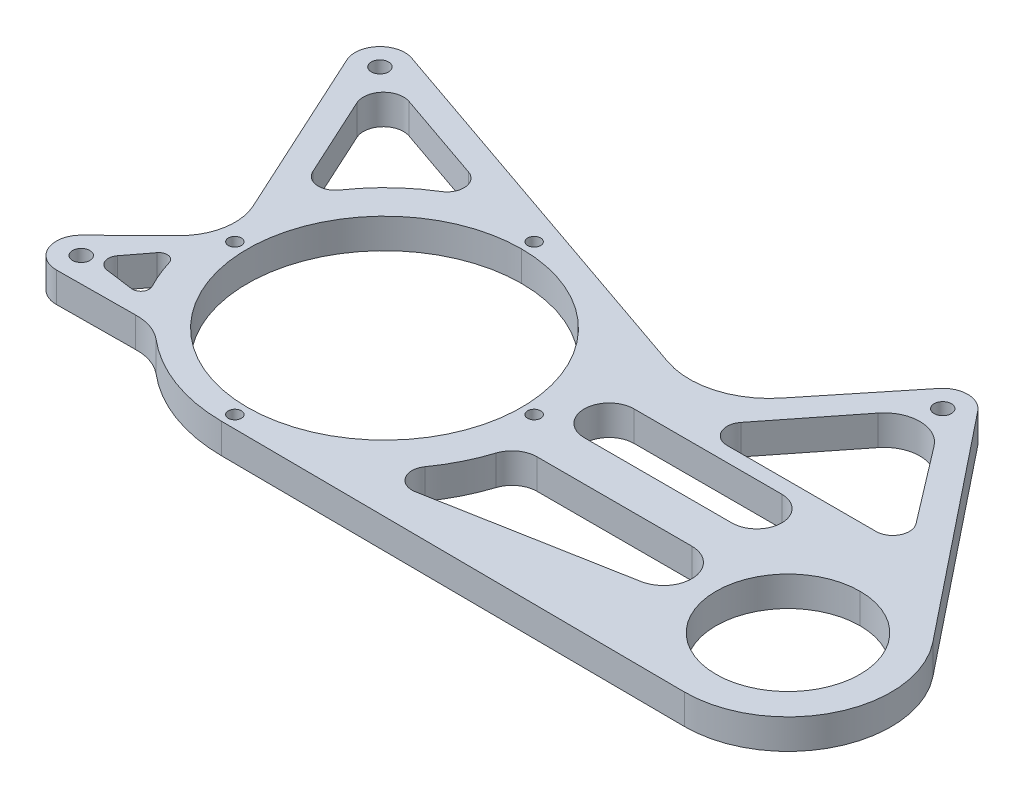
from build123d import *

# Parameters (mm, degrees)
SKETCH1_R             = 52.3875
SKETCH1_R_2           = 27.49999999
BOSS_EXTRUDE1_DEPTH   = 11.43
M6_CLEARANCE_HOLE1_D  = 6.6
F_5_0MM_DOWEL_HOLE1_D = 5
CIRPATTERN1_COUNT     = 4
CUT_EXTRUDE1_DEPTH    = 277.04812471
CUT_EXTRUDE2_DEPTH    = 277.04812471


with BuildPart() as part:
    # Sketch1 → Boss-Extrude1 (new body)
    with BuildSketch(Plane(origin=(0, 0, 0), x_dir=(1, 0, 0), z_dir=(0, 1, 0))):
        with BuildLine():
            Line((-207.352675902, -8.773903901), (-58.019530206, -60.290898352))
            ThreePointArc((-58.019530206, -60.290898352), (-39.599212065, -60.776397748), (-24.240097525, -50.595954211))
            Line((-24.240097525, -50.595954211), (2.624995443, -17.347825368))
            ThreePointArc((2.624995443, -17.347825368), (10.061549983, -13.809238065), (17.477288292, -17.391244328))
            Line((17.477288292, -17.391244328), (85.376811489, -102.435794114))
            ThreePointArc((85.376811489, -102.435794114), (90.030312626, -144.187156643), (54.354134393, -166.369168556))
            Line((54.354134393, -166.369168556), (-123.592369302, -165.212669907))
            ThreePointArc((-123.592369302, -165.212669907), (-144.74612022, -161.34018293), (-163.299086644, -150.465222234))
            ThreePointArc((-163.299086644, -150.465222234), (-168.867064733, -147.400846083), (-175.155117318, -146.477170878))
            Line((-175.155117318, -146.477170878), (-205.054266123, -146.707116576))
            ThreePointArc((-205.054266123, -146.707116576), (-213.929698734, -140.822073907), (-211.802405396, -130.387436669))
            Line((-211.802405396, -130.387436669), (-193.092894011, -112.008542149))
            ThreePointArc((-193.092894011, -112.008542149), (-187.088381157, -100.6982482), (-188.678110669, -87.991962988))
            Line((-188.678110669, -87.991962988), (-219.113977597, -21.755141651))
            ThreePointArc((-219.113977597, -21.755141651), (-217.51766362, -11.382814462), (-207.352675902, -8.773903901))
        make_face()
        with Locations(Location((-123.19, -103.30147742, 0), (0, 0, 270))):
            Circle(SKETCH1_R, mode=Mode.SUBTRACT)
        with Locations(Location((54.61, -127, 0), (0, 0, 270))):
            Circle(SKETCH1_R_2, mode=Mode.SUBTRACT)
    extrude(amount=BOSS_EXTRUDE1_DEPTH)

    # M6 Clearance Hole1 (through all)
    with Locations(Plane(origin=(0, 0, 0), x_dir=(-1, 0, 0), z_dir=(0, -1, 0))):
        with Locations((-10.033704867, -23.334197365), (210.458966133, -17.778157673), (205.127517975, -137.182398252)):
            Hole(M6_CLEARANCE_HOLE1_D / 2)

    # Ø5.0mm Dowel Hole1 (through all)
    with Locations(Plane(origin=(0, 0, 0), x_dir=(-1, 0, 0), z_dir=(0, -1, 0))):
        with Locations((123.19, -160.45147742)):
            f_5_0mm_dowel_hole1 = Hole(F_5_0MM_DOWEL_HOLE1_D / 2)

    # CirPattern1: Ø5.0mm Dowel Hole1 ×4 about axis
    cirpattern1_axis = Axis((-123.19, 0, 103.30147742), (0, 1, 0))
    for i in range(1, CIRPATTERN1_COUNT):
        add(f_5_0mm_dowel_hole1.rotate(cirpattern1_axis, i * 360 / CIRPATTERN1_COUNT), mode=Mode.SUBTRACT)

    # Sketch6 → Cut-Extrude1 (cut, through all)
    with BuildSketch(Plane.XZ):
        with BuildLine():
            Line((-23.944258321, 66.390441023), (-0.829614149, 37.099993387))
            ThreePointArc((-0.829614149, 37.099993387), (9.965816041, 31.919797806), (20.677978855, 37.270060145))
            Line((20.677978855, 37.270060145), (42.980839674, 66.469760223))
            ThreePointArc((42.980839674, 66.469760223), (43.626492897, 73.139052969), (37.934473227, 76.674197365))
            Line((37.934473227, 76.674197365), (-18.959475373, 76.674197365))
            ThreePointArc((-18.959475373, 76.674197365), (-24.673574285, 73.093957935), (-23.944258321, 66.390441023))
        make_face()
        with BuildLine():
            Line((-202.975515938, 34.064204485), (-188.656140545, 65.227105539))
            ThreePointArc((-188.656140545, 65.227105539), (-183.31891043, 68.976517371), (-177.425759363, 66.18100581))
            ThreePointArc((-177.425759363, 66.18100581), (-168.46871459, 55.664464381), (-157.511328264, 47.252450377))
            ThreePointArc((-157.511328264, 47.252450377), (-154.454895213, 41.026593051), (-158.781442678, 35.605885581))
            Line((-158.781442678, 35.605885581), (-193.515753631, 23.623232324))
            ThreePointArc((-193.515753631, 23.623232324), (-201.691580607, 25.721611775), (-202.975515938, 34.064204485))
        make_face()
        with BuildLine():
            Line((-195.382759208, 137.08408238), (-184.602414462, 138.548107412))
            ThreePointArc((-184.602414462, 138.548107412), (-181.561941078, 137.21737146), (-181.352428173, 133.905054912))
            ThreePointArc((-181.352428173, 133.905054912), (-183.92504724, 128.415239444), (-185.980839898, 122.711717787))
            ThreePointArc((-185.980839898, 122.711717787), (-188.468463156, 120.514659048), (-191.560851772, 121.719843357))
            Line((-191.560851772, 121.719843357), (-198.159072812, 130.369853834))
            ThreePointArc((-198.159072812, 130.369853834), (-198.701393345, 134.525214763), (-195.382759208, 137.08408238))
        make_face()
    extrude(amount=-CUT_EXTRUDE1_DEPTH, mode=Mode.SUBTRACT)

    # Sketch7 → Cut-Extrude2 (cut, through all)
    with BuildSketch(Plane.XZ):
        with BuildLine():
            Line((-48.815667356, 101.39647742), (7.572332644, 101.39647742))
            ThreePointArc((7.572332644, 101.39647742), (17.097332644, 91.87147742), (7.572332644, 82.34647742))
            Line((7.572332644, 82.34647742), (-48.815667356, 82.34647742))
            ThreePointArc((-48.815667356, 82.34647742), (-58.340667356, 91.87147742), (-48.815667356, 101.39647742))
        make_face()
        with BuildLine():
            Line((-63.185512617, 151.524232803), (9.527948512, 138.12987842))
            ThreePointArc((9.527948512, 138.12987842), (18.322585695, 126.531617281), (7.572332644, 116.718495252))
            Line((7.572332644, 116.718495252), (-51.525154545, 116.718495252))
            ThreePointArc((-51.525154545, 116.718495252), (-57.140513894, 118.54977285), (-60.59665397, 123.339442362))
            ThreePointArc((-60.59665397, 123.339442362), (-64.418746701, 132.718934684), (-69.636607751, 141.399786896))
            ThreePointArc((-69.636607751, 141.399786896), (-69.82125671, 148.634919104), (-63.185512617, 151.524232803))
        make_face()
    extrude(amount=-CUT_EXTRUDE2_DEPTH, mode=Mode.SUBTRACT)


solid = part.part
